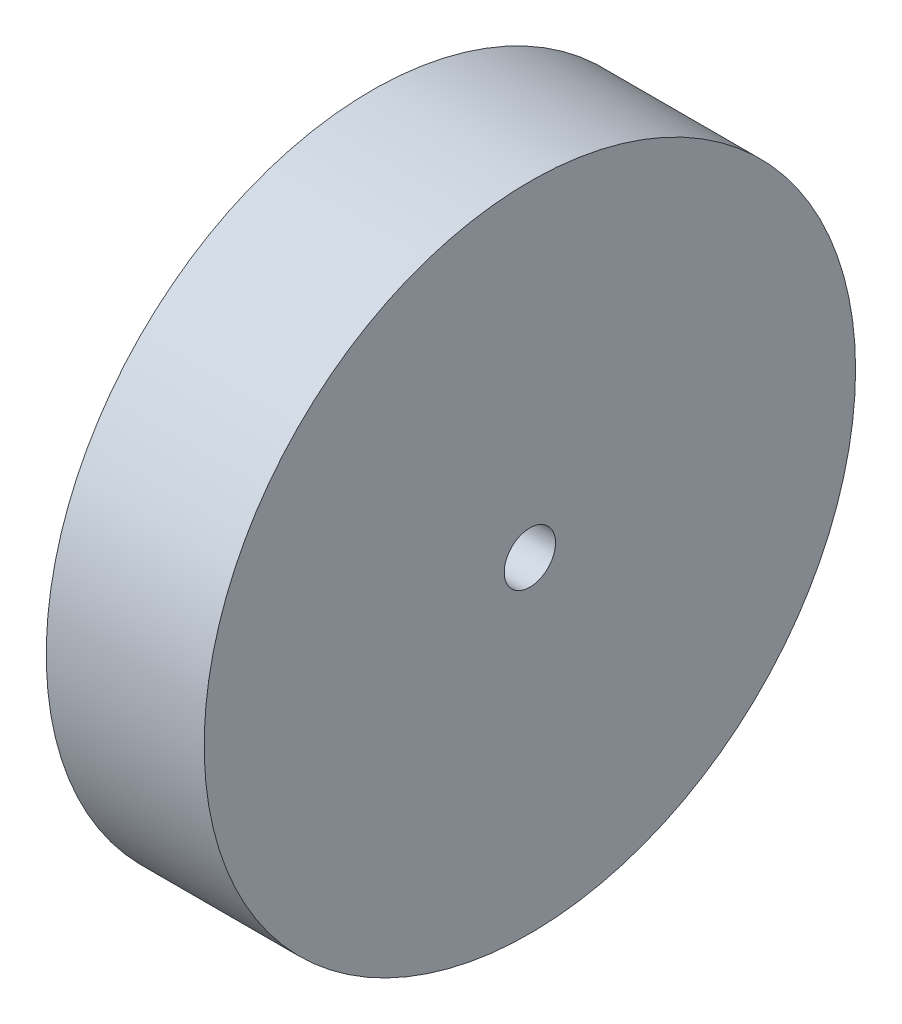
from build123d import *

# Parameters (mm, degrees)
SKETCH_1_R          = 33
EXTRUDE_1_DEPTH     = 16
SKETCH_2_R          = 2.6
CUT_EXTRUDE_1_DEPTH = 16


with BuildPart() as part:
    # 草图1 → 凸台-拉伸1 (new body)
    with BuildSketch(Plane(origin=(0, 0, 0), x_dir=(0, 0, -1), z_dir=(1, 0, 0))):
        Circle(SKETCH_1_R)
    extrude(amount=EXTRUDE_1_DEPTH)

    # 草图2 → 切除-拉伸1 (cut)
    with BuildSketch(Plane(origin=(16, 0, 0), x_dir=(0, 0, -1), z_dir=(1, 0, 0))):
        Circle(SKETCH_2_R)
    extrude(amount=-CUT_EXTRUDE_1_DEPTH, mode=Mode.SUBTRACT)


solid = part.part
